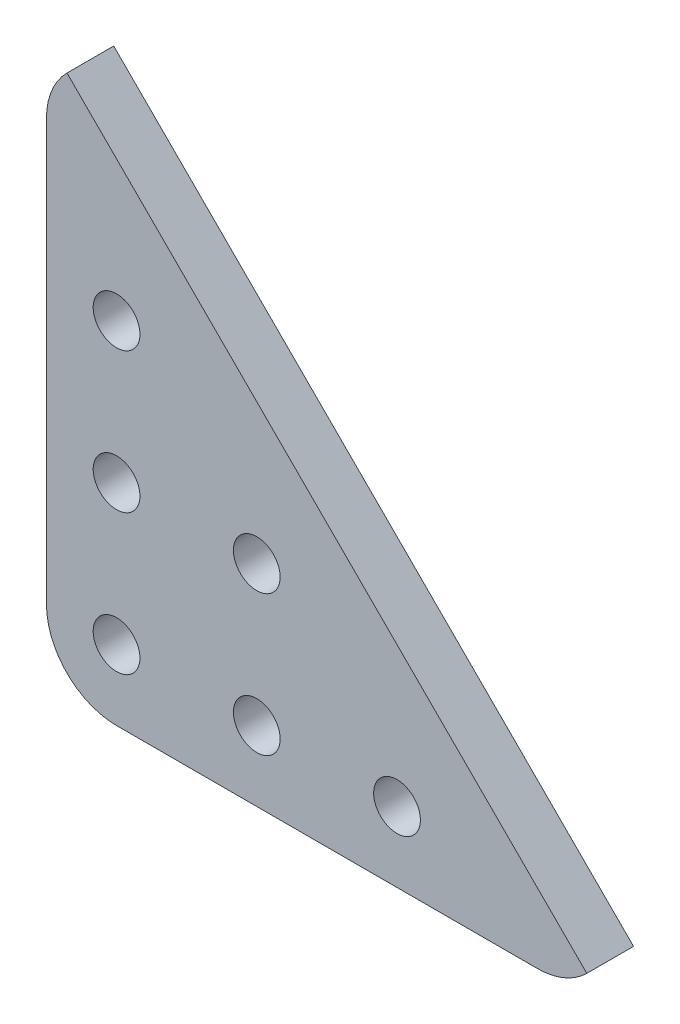
from build123d import *

# Parameters (mm, degrees)
MODEL_R                 = 1.5
SALIENTE_EXTRUIR1_DEPTH = 3


with BuildPart() as part:
    # Model → Saliente-Extruir1 (new body)
    with BuildSketch(Plane.XY):
        with BuildLine():
            Line((-105.943383637, 101.056539338), (-105.943383637, 74.056539338))
            ThreePointArc((-105.943383637, 74.056539338), (-104.625364152, 70.874558823), (-101.443383637, 69.556539338))
            Line((-101.443383637, 69.556539338), (-74.443383637, 69.556539338))
            ThreePointArc((-74.443383637, 69.556539338), (-72.721308191, 69.899081442), (-71.261403122, 70.874558823))
            Line((-71.261403122, 70.874558823), (-104.625364152, 104.238519853))
            ThreePointArc((-104.625364152, 104.238519853), (-105.600841533, 102.778614784), (-105.943383637, 101.056539338))
        make_face()
        with Locations((-101.443383637, 92.056539338)):
            Circle(MODEL_R, mode=Mode.SUBTRACT)
        with Locations((-101.443383637, 83.056539338)):
            Circle(MODEL_R, mode=Mode.SUBTRACT)
        with Locations((-92.443383637, 83.056539338)):
            Circle(MODEL_R, mode=Mode.SUBTRACT)
        with Locations((-101.443383637, 74.056539338)):
            Circle(MODEL_R, mode=Mode.SUBTRACT)
        with Locations((-92.443383637, 74.056539338)):
            Circle(MODEL_R, mode=Mode.SUBTRACT)
        with Locations((-83.443383637, 74.056539338)):
            Circle(MODEL_R, mode=Mode.SUBTRACT)
    extrude(amount=SALIENTE_EXTRUIR1_DEPTH)


solid = part.part
